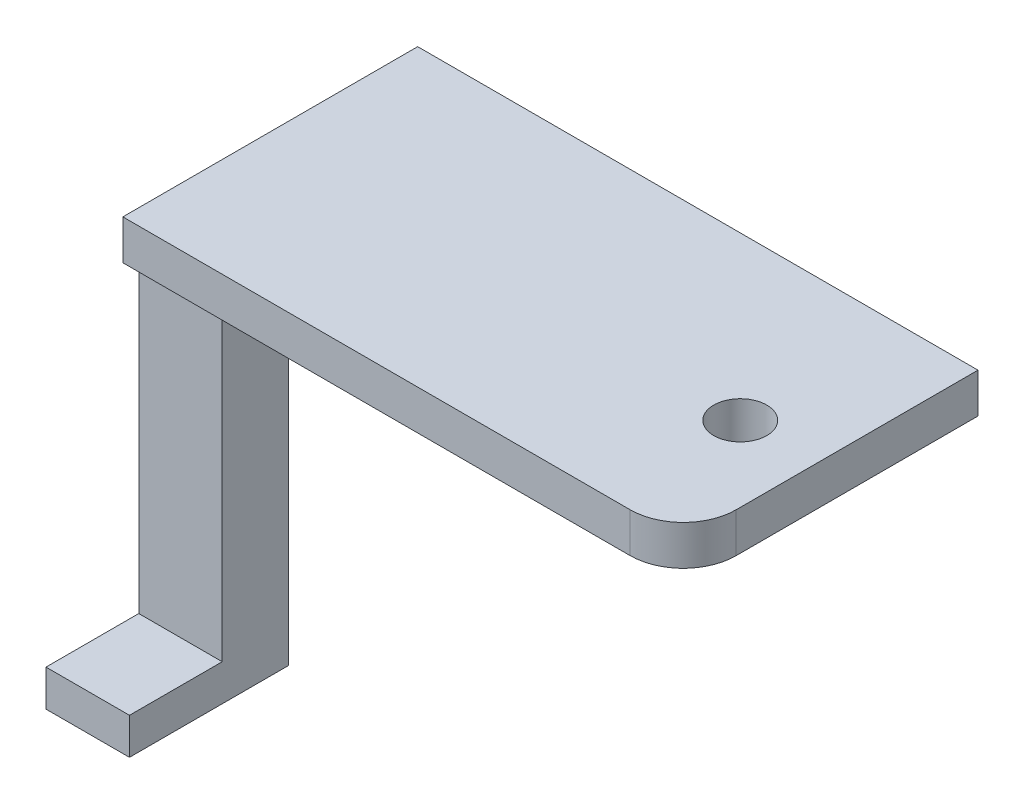
from build123d import *

# Parameters (mm, degrees)
SKETCH1_R           = 2
SKETCH1_W           = 6.3
SKETCH1_H           = 5
BOSS_EXTRUDE1_DEPTH = 3
SKETCH4_W           = 6.3
SKETCH4_H           = 5
BOSS_EXTRUDE3_DEPTH = 23.525
SKETCH5_W           = 6.3
SKETCH5_H           = 12
BOSS_EXTRUDE4_DEPTH = 2.75


with BuildPart() as part:
    # Sketch1 → Boss-Extrude1 (new body)
    # profile 1 of 2: a face of its own
    with BuildSketch(Plane(origin=(0, 0, 0), x_dir=(1, 0, 0), z_dir=(0, 1, 0))):
        with BuildLine():
            Line((-35.984691362, 0), (-4, 0))
            ThreePointArc((-4, 0), (-1.171572875, 1.171572875), (0, 4))
            Line((0, 4), (0, 20))
            Line((0, 20), (0, 22.25))
            Line((0, 22.25), (-42.284691362, 22.25))
            Line((-42.284691362, 22.25), (-42.284691362, 20))
            Line((-42.284691362, 20), (-42.284691362, 5))
            Line((-42.284691362, 5), (-35.984691362, 5))
            Line((-35.984691362, 5), (-35.984691362, 0))
        make_face()
        with Locations(Location((-5.69, 10, 0), (0, 0, 270))):
            Circle(SKETCH1_R, mode=Mode.SUBTRACT)
    # profile 2 of 2: a face of its own
    with BuildSketch(Plane(origin=(0, 0, 0), x_dir=(1, 0, 0), z_dir=(0, 1, 0))):
        with Locations((-39.134691362, 2.5)):
            Rectangle(SKETCH1_W, SKETCH1_H)
    extrude(amount=BOSS_EXTRUDE1_DEPTH)

    # Sketch4 → Boss-Extrude3 (add)
    with BuildSketch(Plane.XZ):
        with Locations((-39.134691362, -3.7)):
            Rectangle(SKETCH4_W, SKETCH4_H)
    extrude(amount=BOSS_EXTRUDE3_DEPTH)

    # Sketch5 → Boss-Extrude4 (add)
    with BuildSketch(Plane(origin=(0, -23.525, 0), x_dir=(-1, 0, 0), z_dir=(0, -1, 0))):
        with Locations((39.134691362, 0.2)):
            Rectangle(SKETCH5_W, SKETCH5_H)
    extrude(amount=BOSS_EXTRUDE4_DEPTH)


solid = part.part
